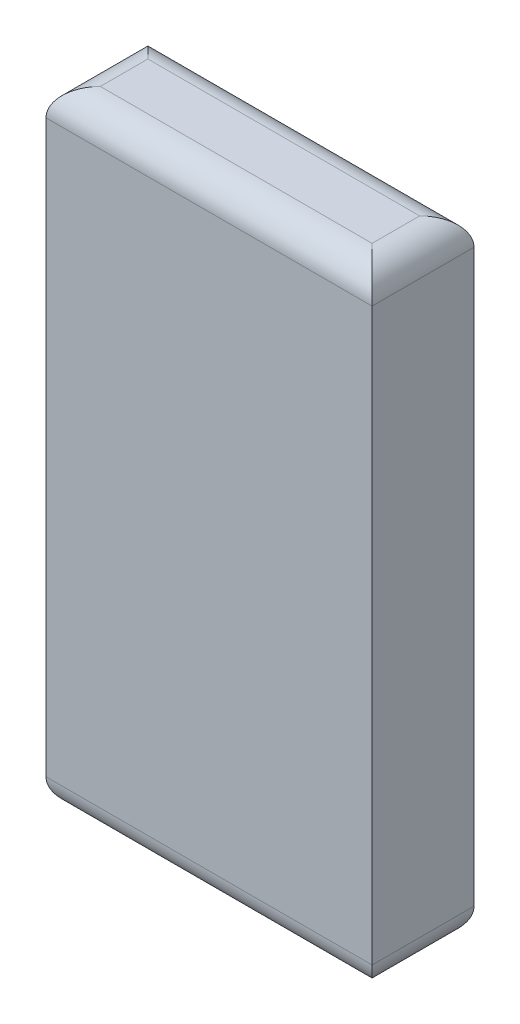
from build123d import *

# Parameters (mm, degrees)
SKETCH1_W           = 30.48
SKETCH1_H           = 58.42
BOSS_EXTRUDE1_DEPTH = 9.525
FILLET1_R           = 2.54


with BuildPart() as part:
    # Sketch1 → Boss-Extrude1 (new body)
    with BuildSketch(Plane.XY):
        with Locations((15.24, 29.21)):
            Rectangle(SKETCH1_W, SKETCH1_H)
    extrude(amount=BOSS_EXTRUDE1_DEPTH)

    # Fillet1
    fillet1_edges = [part.edges().sort_by_distance(p)[0] for p in [
        (15.24, 58.42, 9.525),
        (15.24, 58.42, 0),
        (15.24, 0, 0),
        (0, 58.42, 4.7625),
        (30.48, 58.42, 4.7625),
        (30.48, 0, 4.7625),
        (0, 0, 4.7625),
        (15.24, 0, 9.525),
    ]]
    fillet(fillet1_edges, radius=FILLET1_R)


solid = part.part
